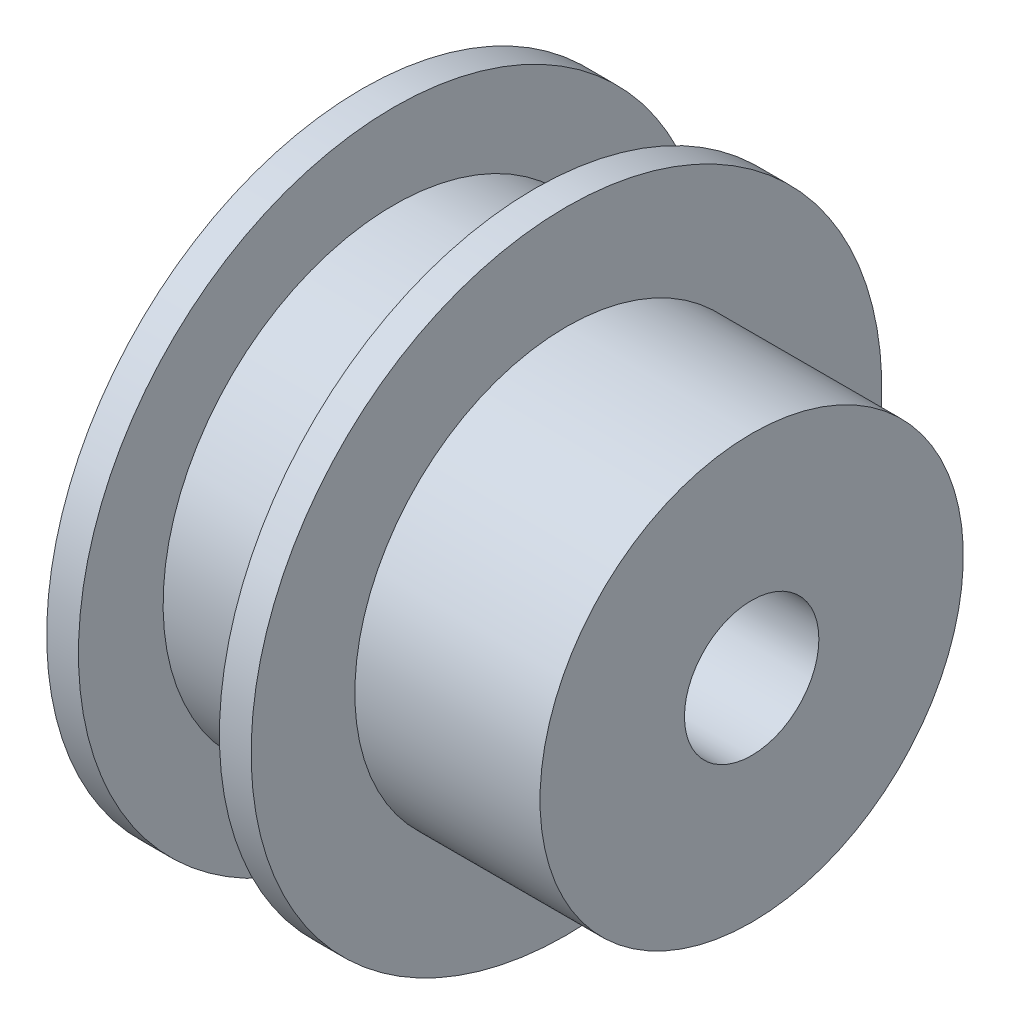
from build123d import *

# Parameters (mm, degrees)
CUT_EXTRUDE1_DEPTH      = 36.02253703
CUT_EXTRUDE1_DEPTH_BACK = 36.02253703
SKETCH4_R               = 3.175


with BuildPart() as part:
    # Sketch1 → Revolve1 (revolve)
    with BuildSketch(Plane.XY, mode=Mode.PRIVATE) as revolve1_sk:
        Polygon((-3.33, 0), (3.33, 0), (3.33, 4), (4.83, 4), (4.83, -0.900000061), (13.58, -0.900000061), (13.58, -10.9), (-4.83, -10.9), (-4.83, 4), (-3.33, 4), align=None)
    revolve(revolve1_sk.sketch.rotate(Axis((-4.83, -10.9, 0), (1, 0, 0)), 180), axis=Axis((-4.83, -10.9, 0), (1, 0, 0)))

    # Sketch4 → Cut-Extrude1 (cut, two sides: drawn at the far end of the back side and taken through both)
    with BuildSketch(Plane(origin=(13.58, 0, 0), x_dir=(0, 0, -1), z_dir=(1, 0, 0)).offset(-CUT_EXTRUDE1_DEPTH_BACK)):
        with Locations(Location((0, -10.9, 0), (0, 0, 90))):
            Circle(SKETCH4_R)
    extrude(amount=CUT_EXTRUDE1_DEPTH + CUT_EXTRUDE1_DEPTH_BACK, mode=Mode.SUBTRACT)


solid = part.part
